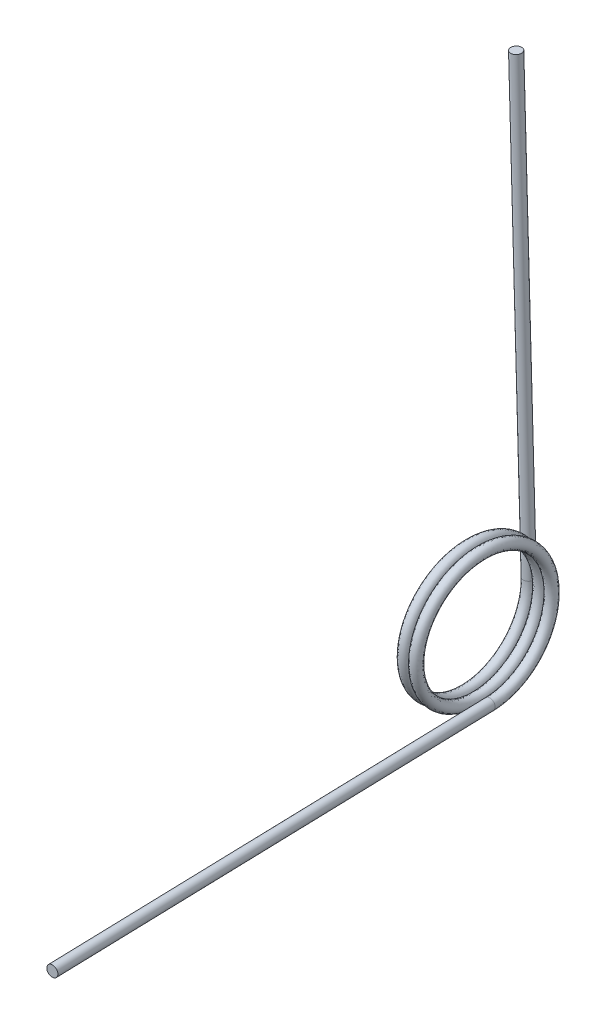
from build123d import *

# Parameters (mm, degrees)
SWEEP1_PITCH       = 0.4826
SWEEP1_HEIGHT      = 1.08585
SWEEP1_RADIUS      = 2.7432
SWEEP1_START_ANGLE = -180
SKETCH2_R          = 0.2286
SKETCH3_R          = 0.2286
EXTRUDE1_DEPTH     = 19.05
SKETCH4_R          = 0.2286
EXTRUDE2_DEPTH     = 19.05


with BuildPart() as part:
    # Sweep1: sweep along a helix
    with BuildLine() as sweep1_path:
        add(Helix(SWEEP1_PITCH, SWEEP1_HEIGHT, SWEEP1_RADIUS, center=(0, 0, 0), direction=(1, 0, 0), lefthand=True, mode=Mode.PRIVATE).rotate(Axis((0, 0, 0), (1, 0, 0)), SWEEP1_START_ANGLE))
    # Sketch2 → Sweep1 (sweep)
    with BuildSketch(Plane(origin=(0, 0, -2.7432), x_dir=(0.9996082448678808, 0.027988511788857362, 0), z_dir=(0.027988511788857362, -0.9996082448678808, 0))):
        Circle(SKETCH2_R)
    sweep(path=sweep1_path.line, is_frenet=True)

    # Sketch3 → Extrude1 (add)
    with BuildSketch(Plane(origin=(0, 0, 0), x_dir=(-0.9996082448678808, -0.027988511788857362, 0), z_dir=(-0.027988511788857362, 0.9996082448678808, 0))):
        with Locations(Location((0, -2.7432, 0), (0, 0, 180))):
            Circle(SKETCH3_R)
    extrude(amount=EXTRUDE1_DEPTH)

    # Sketch4 → Extrude2 (add)
    with BuildSketch(Plane(origin=(0.000850608, 0, 0.03037942), x_dir=(0.9996082448678809, -2.1282855332066037e-15, -0.027988511788857365), z_dir=(0.027988511788857365, 3.1411039991255645e-14, 0.9996082448678809))):
        with Locations((1.085424613, -2.7432)):
            Circle(SKETCH4_R)
    extrude(amount=EXTRUDE2_DEPTH)


solid = part.part
